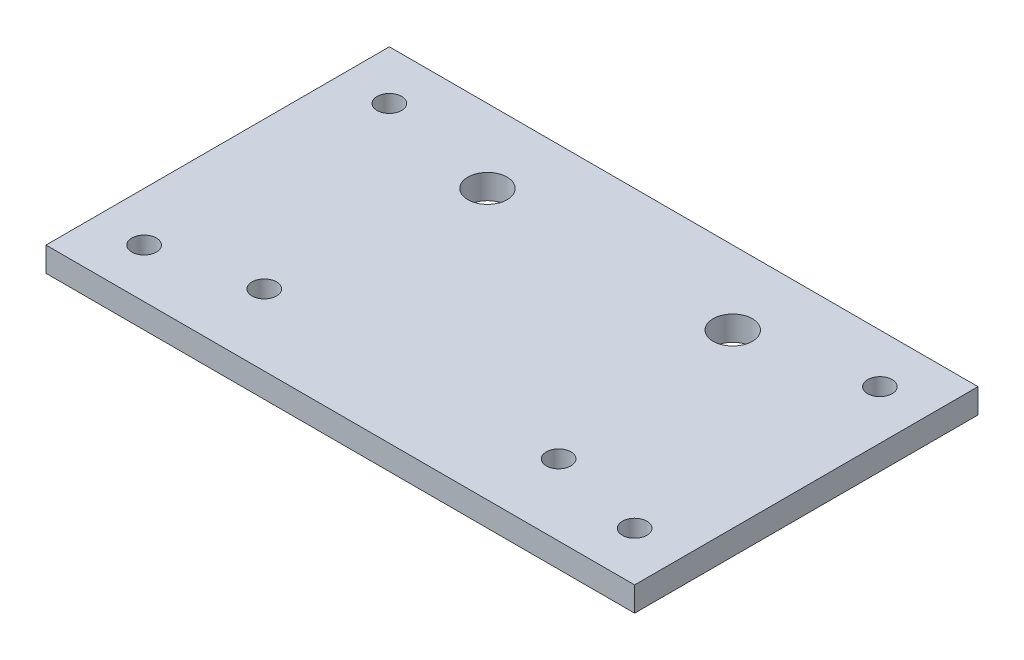
from build123d import *

# Parameters (mm, degrees)
SKETCH1_W           = 120
SKETCH1_H           = 70
SKETCH1_R           = 4
SKETCH1_R_2         = 2.5
BOSS_EXTRUDE1_DEPTH = 5


with BuildPart() as part:
    # Sketch1 → Boss-Extrude1 (new body)
    with BuildSketch(Plane(origin=(0, 0, 0), x_dir=(1, 0, 0), z_dir=(0, 1, 0))):
        with Locations((60, -32.05400982)):
            Rectangle(SKETCH1_W, SKETCH1_H)
        with Locations(Location((35, -12.05400982, 0), (0, 0, 270))):
            Circle(SKETCH1_R, mode=Mode.SUBTRACT)
        with Locations(Location((85, -12.05400982, 0), (0, 0, 270))):
            Circle(SKETCH1_R, mode=Mode.SUBTRACT)
        with Locations(Location((10, -57.05400982, 0), (0, 0, 270))):
            Circle(SKETCH1_R_2, mode=Mode.SUBTRACT)
        with Locations(Location((10, -7.05400982, 0), (0, 0, 270))):
            Circle(SKETCH1_R_2, mode=Mode.SUBTRACT)
        with Locations(Location((30, -52.55400982, 0), (0, 0, 270))):
            Circle(SKETCH1_R_2, mode=Mode.SUBTRACT)
        with Locations(Location((90, -52.55400982, 0), (0, 0, 270))):
            Circle(SKETCH1_R_2, mode=Mode.SUBTRACT)
        with Locations(Location((110, -57.05400982, 0), (0, 0, 270))):
            Circle(SKETCH1_R_2, mode=Mode.SUBTRACT)
        with Locations(Location((110, -7.05400982, 0), (0, 0, 270))):
            Circle(SKETCH1_R_2, mode=Mode.SUBTRACT)
    extrude(amount=BOSS_EXTRUDE1_DEPTH)


solid = part.part
